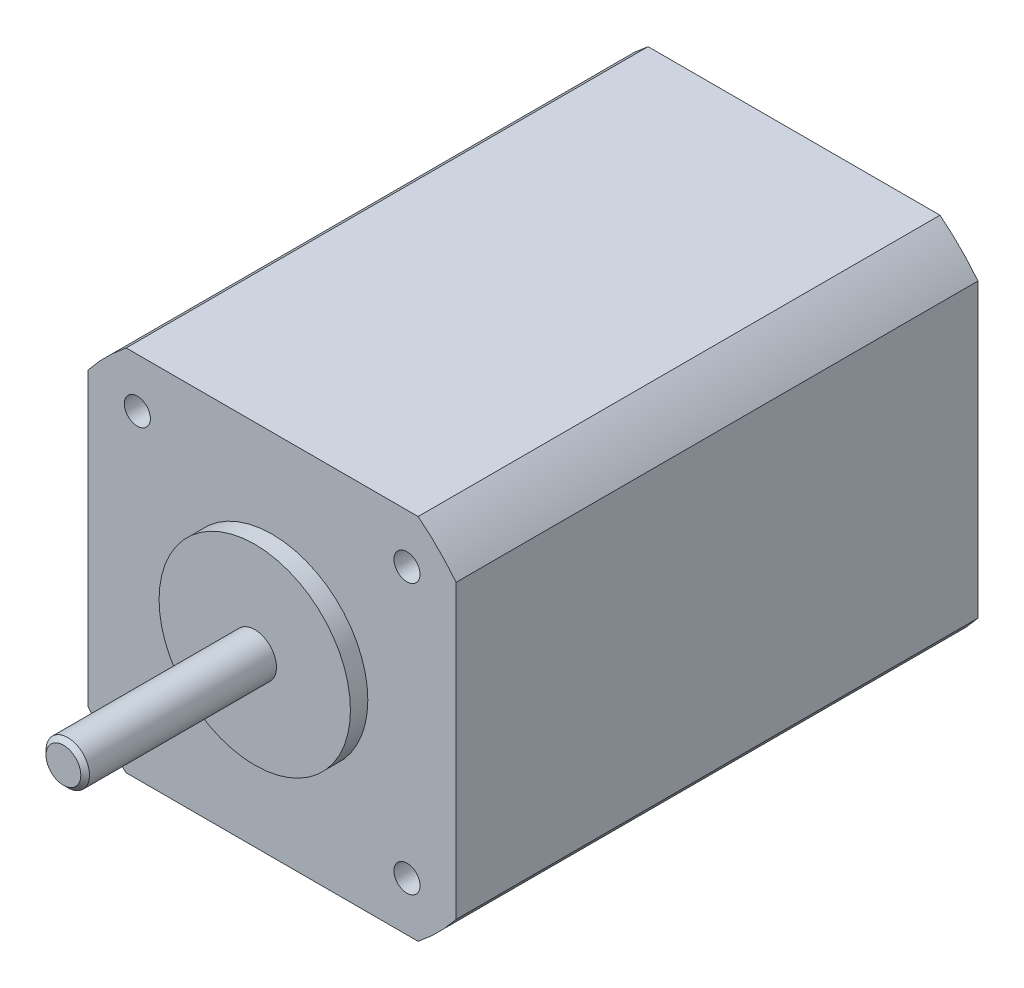
from build123d import *

# Parameters (mm, degrees)
SKETCH1_W           = 42.3
SKETCH1_H           = 42.3
BOSS_EXTRUDE1_DEPTH = 60
SKETCH2_R           = 1.5
CUT_EXTRUDE1_DEPTH  = 4.5
SKETCH3_W           = 70.080041738
SKETCH3_H           = 62.101106944
SKETCH3_R           = 27
CUT_EXTRUDE2_DEPTH  = 68.04211363
SKETCH4_R           = 11
BOSS_EXTRUDE2_DEPTH = 2
SKETCH5_R           = 2.5
BOSS_EXTRUDE3_DEPTH = 24
CHAMFER1_SIZE       = 0.5


with BuildPart() as part:
    # Sketch1 → Boss-Extrude1 (new body)
    with BuildSketch(Plane.XY):
        Rectangle(SKETCH1_W, SKETCH1_H)
    extrude(amount=BOSS_EXTRUDE1_DEPTH)

    # Sketch2 → Cut-Extrude1 (cut)
    with BuildSketch(Plane.XY.offset(60)):
        with Locations((-15.5, 15.5)):
            Circle(SKETCH2_R)
        with Locations((-15.5, -15.5)):
            Circle(SKETCH2_R)
        with Locations((15.5, -15.5)):
            Circle(SKETCH2_R)
        with Locations((15.5, 15.5)):
            Circle(SKETCH2_R)
    extrude(amount=-CUT_EXTRUDE1_DEPTH, mode=Mode.SUBTRACT)

    # Sketch3 → Cut-Extrude2 (cut, through all)
    with BuildSketch(Plane.XY.offset(60)):
        Rectangle(SKETCH3_W, SKETCH3_H)
        Circle(SKETCH3_R, mode=Mode.SUBTRACT)
    extrude(amount=-CUT_EXTRUDE2_DEPTH, mode=Mode.SUBTRACT)

    # Sketch4 → Boss-Extrude2 (add)
    with BuildSketch(Plane.XY.offset(60)):
        Circle(SKETCH4_R)
    extrude(amount=BOSS_EXTRUDE2_DEPTH)

    # Sketch5 → Boss-Extrude3 (add)
    with BuildSketch(Plane.XY.offset(60)):
        Circle(SKETCH5_R)
    extrude(amount=BOSS_EXTRUDE3_DEPTH)

    # Chamfer1
    chamfer1_edges = [part.edges().sort_by_distance(p)[0] for p in [
        (-2.5, 0, 84),
    ]]
    chamfer(chamfer1_edges, length=CHAMFER1_SIZE)


solid = part.part
